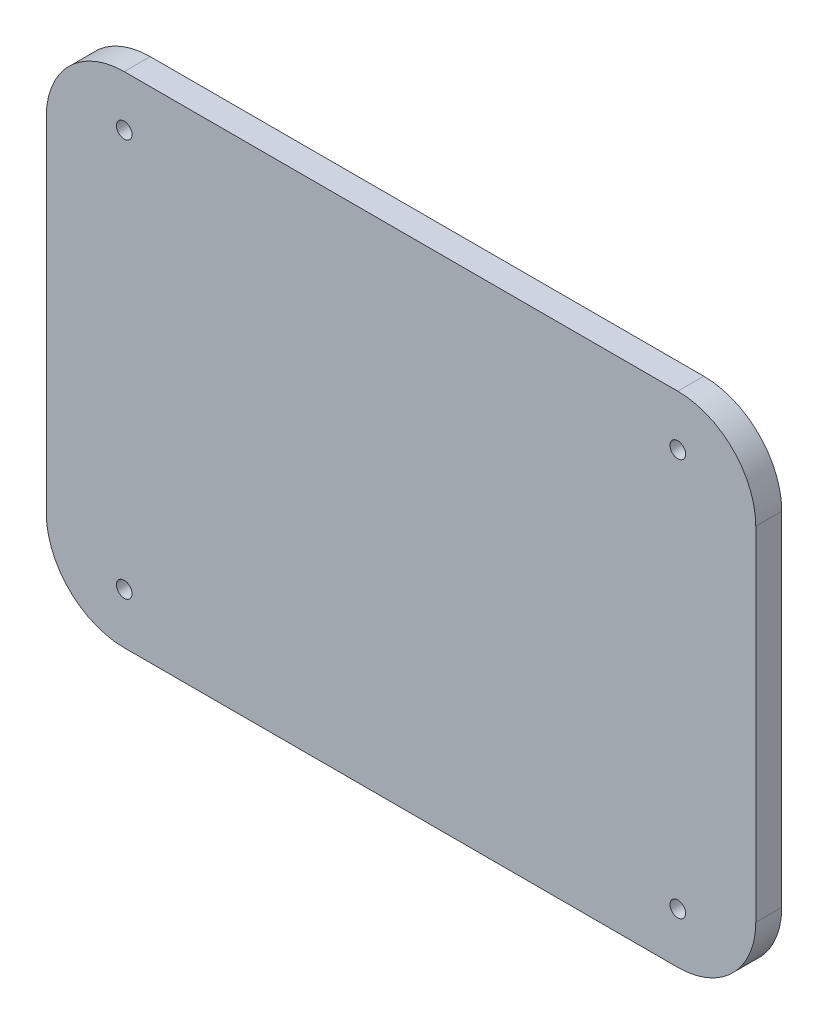
from build123d import *

# Parameters (mm, degrees)
SKETCH2_R           = 1.5
BOSS_EXTRUDE1_DEPTH = 5


with BuildPart() as part:
    # Sketch2 → Boss-Extrude1 (new body)
    with BuildSketch(Plane.XY):
        with BuildLine():
            Line((792.944636851, 1099.1431403), (882.944636851, 1099.1431403))
            Line((882.944636851, 1099.1431403), (891.194636851, 1099.1431403))
            ThreePointArc((891.194636851, 1099.1431403), (901.801238569, 1094.749742018), (906.194636851, 1084.1431403))
            Line((906.194636851, 1084.1431403), (906.194636851, 1018.1431403))
            ThreePointArc((906.194636851, 1018.1431403), (901.801238569, 1007.536538582), (891.194636851, 1003.1431403))
            Line((891.194636851, 1003.1431403), (784.694636851, 1003.1431403))
            ThreePointArc((784.694636851, 1003.1431403), (774.088035133, 1007.536538582), (769.694636851, 1018.1431403))
            Line((769.694636851, 1018.1431403), (769.694636851, 1084.1431403))
            ThreePointArc((769.694636851, 1084.1431403), (774.088035133, 1094.749742018), (784.694636851, 1099.1431403))
            Line((784.694636851, 1099.1431403), (792.944636851, 1099.1431403))
        make_face()
        with Locations((784.694636851, 1089.3931403)):
            Circle(SKETCH2_R, mode=Mode.SUBTRACT)
        with Locations((784.694636851, 1012.8931403)):
            Circle(SKETCH2_R, mode=Mode.SUBTRACT)
        with Locations((891.194636851, 1012.8931403)):
            Circle(SKETCH2_R, mode=Mode.SUBTRACT)
        with Locations((891.194636851, 1089.3931403)):
            Circle(SKETCH2_R, mode=Mode.SUBTRACT)
    extrude(amount=BOSS_EXTRUDE1_DEPTH)


solid = part.part
